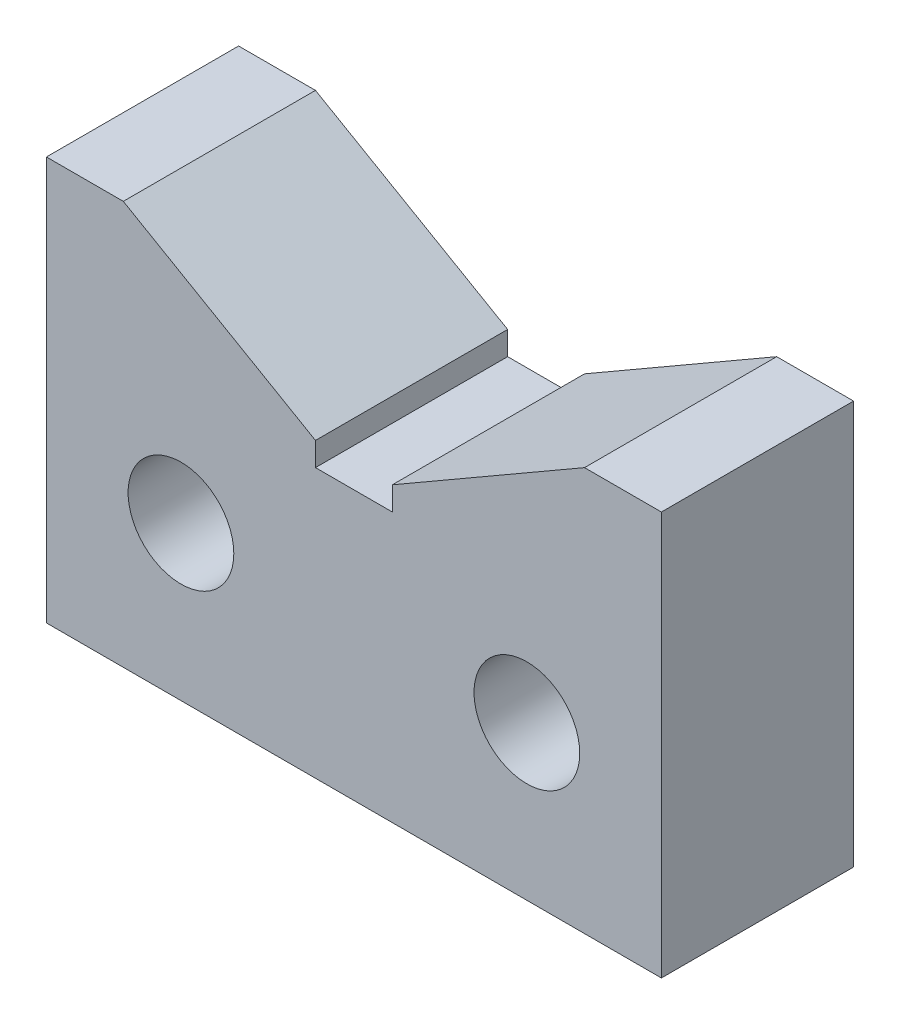
from build123d import *

# Parameters (mm, degrees)
SKETCH_1_R      = 2.75
EXTRUDE_1_DEPTH = 10


with BuildPart() as part:
    # Эскиз1 → Бобышка-Вытянуть1 (new body)
    # profile 1 of 2: a face of its own
    with BuildSketch(Plane.XY):
        Polygon((-16, 0), (0, 0), (0, 14), (-2, 14), (-2, 15.226497308), (-12, 21), (-16, 21), align=None)
        with Locations((-9, 8)):
            Circle(SKETCH_1_R, mode=Mode.SUBTRACT)
    # profile 2 of 2: a face of its own
    with BuildSketch(Plane.XY):
        Polygon((0, 14), (0, 0), (16, 0), (16, 21), (12, 21), (2, 15.226497308), (2, 14), align=None)
        with Locations((9, 8)):
            Circle(SKETCH_1_R, mode=Mode.SUBTRACT)
    extrude(amount=EXTRUDE_1_DEPTH)


solid = part.part
